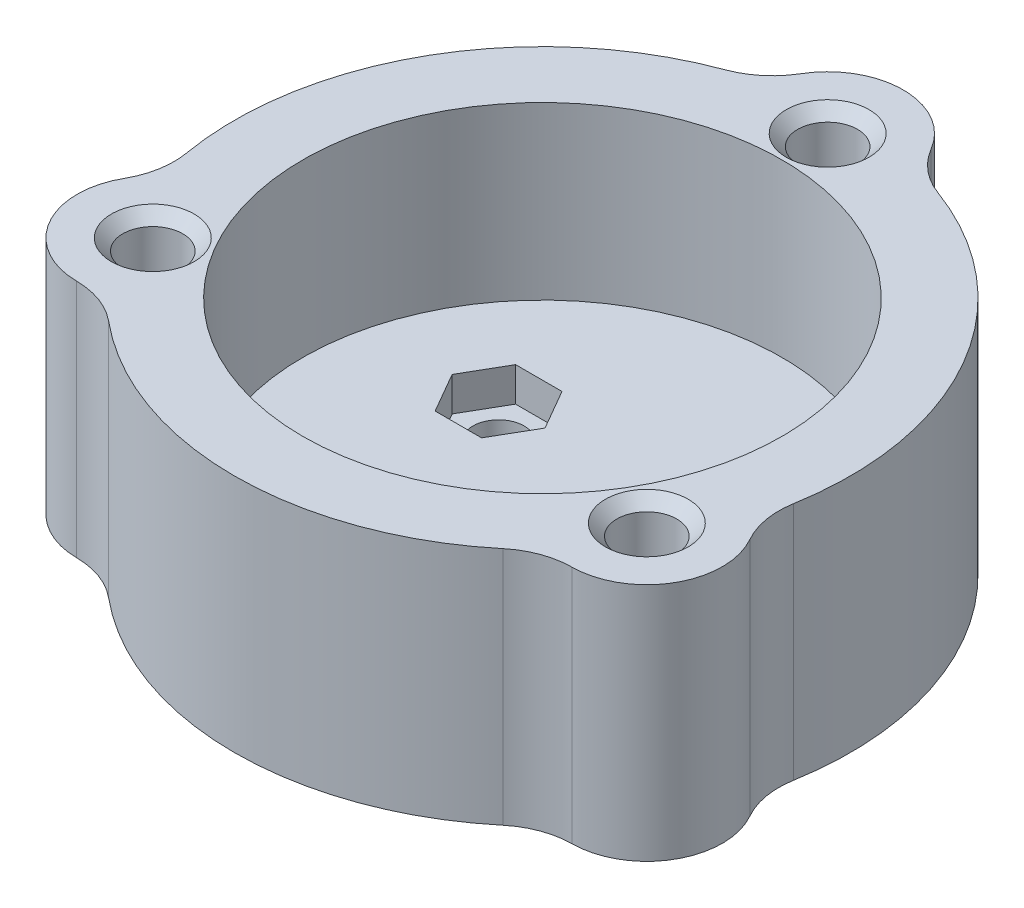
from build123d import *

# Parameters (mm, degrees)
SKETCH_1_R          = 2.625
SKETCH_1_R_2        = 21
EXTRUDE_1_DEPTH     = 15
EXTRUDE_START       = 6
EXTRUDE_2_DEPTH     = 6
FILLET_1_R          = 7
CHAMFER_1_SIZE      = 1
SKETCH_3_R          = 2.25
CUT_EXTRUDE_1_DEPTH = 48.335527685
CUT_EXTRUDE_2_DEPTH = 3


with BuildPart() as part:
    # Эскиз1 → Бобышка-Вытянуть1 (new body)
    with BuildSketch(Plane(origin=(0, 0, 0), x_dir=(1, 0, 0), z_dir=(0, 1, 0))):
        with BuildLine():
            ThreePointArc((25.949265582, -7.458928593), (23.382685902, 13.5), (6.515011145, 26.2021875))
            ThreePointArc((6.515011145, 26.2021875), (0, 31.625), (-6.515011145, 26.2021875))
            ThreePointArc((-6.515011145, 26.2021875), (-23.382685902, 13.5), (-25.949265582, -7.458928593))
            ThreePointArc((-25.949265582, -7.458928593), (-27.388053395, -15.8125), (-19.434254437, -18.743258907))
            ThreePointArc((-19.434254437, -18.743258907), (0, -27), (19.434254437, -18.743258907))
            ThreePointArc((19.434254437, -18.743258907), (27.388053395, -15.8125), (25.949265582, -7.458928593))
        make_face()
        with Locations(Location((0, 25, 0), (0, 0, 270))):
            Circle(SKETCH_1_R, mode=Mode.SUBTRACT)
        with Locations(Location((0, 0, 0), (0, 0, 270))):
            Circle(SKETCH_1_R_2, mode=Mode.SUBTRACT)
        with Locations(Location((-21.650635095, -12.5, 0), (0, 0, 270))):
            Circle(SKETCH_1_R, mode=Mode.SUBTRACT)
        with Locations(Location((21.650635095, -12.5, 0), (0, 0, 270))):
            Circle(SKETCH_1_R, mode=Mode.SUBTRACT)
    extrude(amount=EXTRUDE_1_DEPTH)

    # Эскиз2 → Бобышка-Вытянуть2 (add)
    with BuildSketch(Plane.XZ.offset(EXTRUDE_START)):
        with BuildLine():
            ThreePointArc((25.949265582, 7.458928593), (27.388053395, 15.8125), (19.434254437, 18.743258907))
            ThreePointArc((19.434254437, 18.743258907), (0, 27), (-19.434254437, 18.743258907))
            ThreePointArc((-19.434254437, 18.743258907), (-27.388053395, 15.8125), (-25.949265582, 7.458928593))
            ThreePointArc((-25.949265582, 7.458928593), (-23.382685902, -13.5), (-6.515011145, -26.2021875))
            ThreePointArc((-6.515011145, -26.2021875), (0, -31.625), (6.515011145, -26.2021875))
            ThreePointArc((6.515011145, -26.2021875), (23.382685902, -13.5), (25.949265582, 7.458928593))
        make_face()
    extrude(amount=-EXTRUDE_2_DEPTH)

    # Скругление1
    fillet_1_edges = [part.edges().sort_by_distance(p)[0] for p in [
        (19.434254437, 4.5, 18.743258907),
        (-19.434254437, 4.5, 18.743258907),
        (-25.949265582, 4.5, 7.458928593),
        (-6.515011145, 4.5, -26.2021875),
        (6.515011145, 4.5, -26.2021875),
        (25.949265582, 4.5, 7.458928593),
    ]]
    fillet(fillet_1_edges, radius=FILLET_1_R)

    # Фаска1
    chamfer_1_edges = [part.edges().sort_by_distance(p)[0] for p in [
        (21.650635095, 15, 9.875),
        (0, 15, -27.625),
        (-21.650635095, 15, 9.875),
    ]]
    chamfer(chamfer_1_edges, length=CHAMFER_1_SIZE)

    # Эскиз3 → Вырез-Вытянуть1 (cut, through all)
    with BuildSketch(Plane.XZ.offset(6)):
        with Locations(Location((0, 10.5, 0), (0, 0, 270))):
            Circle(SKETCH_3_R)
        with Locations(Location((9.09326674, -5.25, 0), (0, 0, 270))):
            Circle(SKETCH_3_R)
        with Locations(Location((-9.09326674, -5.25, 0), (0, 0, 270))):
            Circle(SKETCH_3_R)
    extrude(amount=-CUT_EXTRUDE_1_DEPTH, mode=Mode.SUBTRACT)

    # Эскиз4 → Вырез-Вытянуть2 (cut)
    with BuildSketch(Plane(origin=(0, 0, 0), x_dir=(1, 0, 0), z_dir=(0, 1, 0))):
        Polygon((-4.070319398, -10.5), (-2.035159699, -14.025), (2.035159699, -14.025), (4.070319398, -10.5), (2.035159699, -6.975), (-2.035159699, -6.975), align=None)
        Polygon((11.128426439, 1.725), (13.163586138, 5.25), (11.128426439, 8.775), (7.058107041, 8.775), (5.022947342, 5.25), (7.058107041, 1.725), align=None)
        Polygon((-7.058107041, 8.775), (-11.128426439, 8.775), (-13.163586138, 5.25), (-11.128426439, 1.725), (-7.058107041, 1.725), (-5.022947342, 5.25), align=None)
    extrude(amount=-CUT_EXTRUDE_2_DEPTH, mode=Mode.SUBTRACT)


solid = part.part
